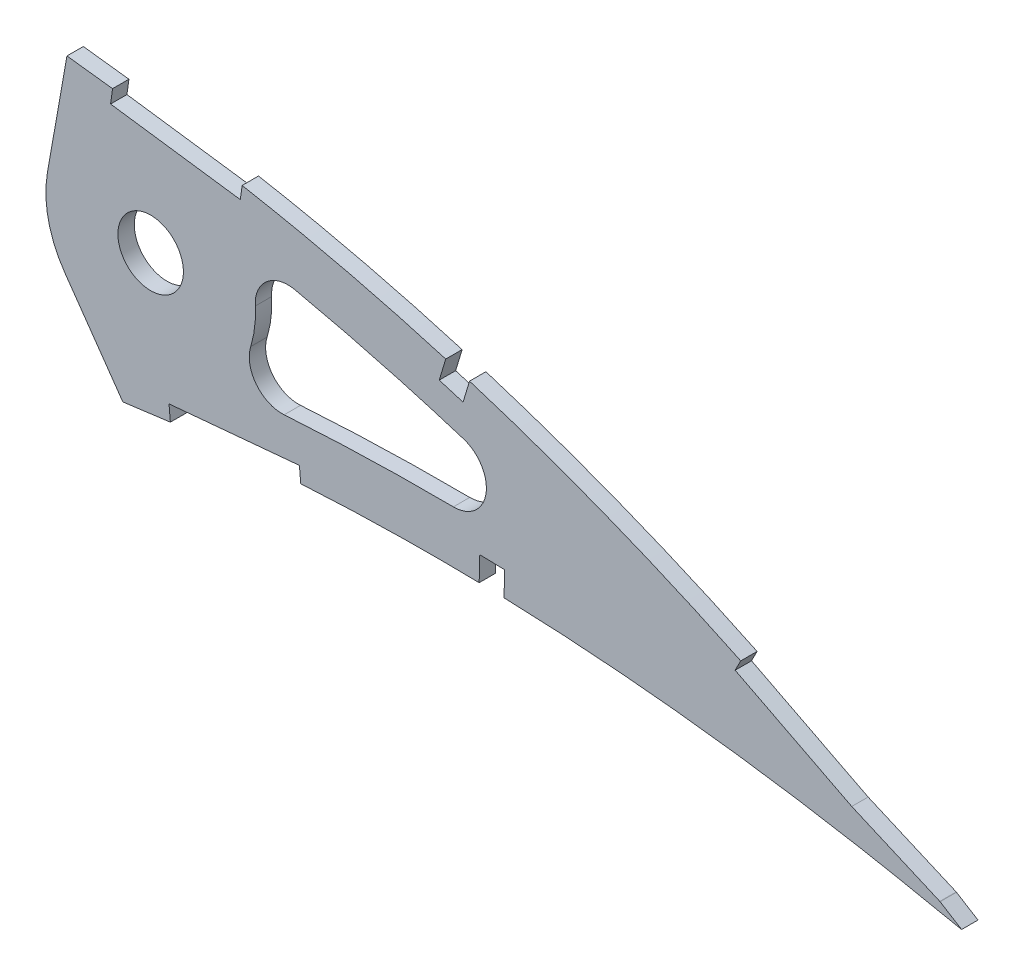
from build123d import *

# Parameters (mm, degrees)
BOSS_EXTRUDE1_DEPTH = 3.175
CUT_EXTRUDE3_DEPTH  = 529.531996169
CUT_EXTRUDE4_DEPTH  = 7.62
FILLET1_R           = 6.35


with BuildPart() as part:
    # Sketch1 → Boss-Extrude1 (new body)
    with BuildSketch(Plane.XY):
        with BuildLine():
            Line((519.580178516, -0.811051185), (524.404942797, -1.768650656))
            Line((524.404942797, -1.768650656), (520.229019484, 0.811051185))
            add(Edge.make_bspline(
                [(520.229019484, 0.811051185), (520.189166605, 0.835670541), (520.029909792, 0.934052399), (519.671075297, 1.154156729), (519.073541109, 1.52075127), (518.237045599, 2.031290225), (517.162238007, 2.684417324), (515.848577801, 3.475559373), (514.296885216, 4.402146321), (512.507535633, 5.459795421), (510.480712337, 6.64355473), (508.21718701, 7.948628257), (505.717156954, 9.367627965), (502.981590452, 10.894755239), (500.011426026, 12.522747531), (496.807225449, 14.244251548), (493.37013628, 16.050511122), (489.701477824, 17.933756977), (485.801919013, 19.88358962), (481.673298347, 21.891894303), (477.316991217, 23.948657398), (472.734484625, 26.042905917), (467.928411224, 28.166102482), (462.900099753, 30.30504754), (457.652415647, 32.45047346), (452.187593096, 34.590170691), (446.508867721, 36.714394111), (440.618430338, 38.809382682), (434.52068427, 40.865980983), (428.218587641, 42.870829), (421.71664718, 44.813038248), (415.018640596, 46.680016502), (408.130151416, 48.4621889), (401.05554842, 50.146576673), (393.800827801, 51.721905645), (386.37175624, 53.178690862), (378.7745642, 54.502388693), (371.03030434, 55.691966852), (363.263579962, 56.681494561), (355.512835044, 57.651994424), (347.773632806, 58.563690257), (339.939841334, 59.436765181), (332.018997168, 60.266303487), (324.018957152, 61.049711288), (315.947820171, 61.783607472), (307.813973652, 62.465839869), (299.625288266, 63.092542591), (291.390398495, 63.662750235), (283.117445562, 64.171449818), (274.815241205, 64.618259557), (266.492213302, 65.000063177), (258.157023363, 65.314229919), (249.818522106, 65.558863312), (241.485365181, 65.731619671), (233.166575282, 65.831412809), (224.870805251, 65.855515939), (216.607073574, 65.803497941), (208.384033719, 65.673572684), (200.210713382, 65.463961556), (192.095777843, 65.174273359), (184.048002143, 64.804633746), (176.076197788, 64.351947189), (168.189012741, 63.819098613), (160.39523005, 63.203849575), (152.703412853, 62.5060365), (145.121622257, 61.728568125), (137.65829938, 60.86932984), (130.321442651, 59.930766435), (123.119077117, 58.914718085), (116.059284027, 57.820631377), (109.149625996, 56.651666482), (102.397560522, 55.409019412), (95.81023125, 54.096333304), (89.394810054, 52.713950514), (83.158087983, 51.266017865), (77.106546628, 49.75505799), (71.246691254, 48.18383703), (65.58446207, 46.556125144), (60.125584795, 44.875615234), (54.876423204, 43.144153764), (49.840944503, 41.368305654), (45.025334256, 39.549331576), (40.433281375, 37.692835265), (36.070167381, 35.80135162), (31.939251719, 33.880646801), (28.045209615, 31.932907511), (24.39081638, 29.963590665), (20.979740738, 27.975715944), (17.815266227, 25.972975661), (14.898722839, 23.96044987), (12.234131686, 21.939401784), (9.822408113, 19.914938493), (7.665078309, 17.890142748), (5.765226023, 15.866409302), (4.122782784, 13.847302025), (2.739901149, 11.834419923), (1.61682102, 9.829667672), (0.75608259, 7.834501578), (0.156832386, 5.85004365), (-0.171193188, 3.879222922), (-0.252840734, 1.920459398), (-0.084154315, 0.639196632), (0, 0)],
                knots=[0, 0, 0, 0, 0.00025409, 0.001015373, 0.002283359, 0.004056577, 0.006330982, 0.009105275, 0.012374489, 0.016134023, 0.02037966, 0.025105976, 0.030306237, 0.035972206, 0.042099522, 0.048678064, 0.055701664, 0.063160184, 0.071045824, 0.079349826, 0.08806291, 0.097175757, 0.106678112, 0.116561573, 0.126814276, 0.1374283, 0.148393618, 0.15969976, 0.171338126, 0.183297699, 0.195569604, 0.208143556, 0.221011593, 0.234161831, 0.24758745, 0.261276822, 0.27522271, 0.289414144, 0.3037712, 0.317689227, 0.331784111, 0.346039677, 0.36044387, 0.374982721, 0.389640455, 0.404403317, 0.419256601, 0.434186749, 0.449177265, 0.464214782, 0.479284009, 0.49436974, 0.509457833, 0.524532346, 0.53957932, 0.554582984, 0.569529546, 0.584403417, 0.599190992, 0.613876838, 0.628447475, 0.642888675, 0.657186054, 0.671325546, 0.685294014, 0.699078147, 0.712665095, 0.726042645, 0.739197713, 0.752117586, 0.764792042, 0.777208152, 0.789355685, 0.80122396, 0.812803686, 0.824082909, 0.835054602, 0.845709571, 0.856037853, 0.866033834, 0.875688843, 0.884997719, 0.893953426, 0.902552897, 0.910789386, 0.918660734, 0.926166253, 0.933302626, 0.94007122, 0.94647478, 0.952517526, 0.958204819, 0.963546652, 0.9685566, 0.973249913, 0.977651041, 0.981787043, 0.985694226, 0.989415109, 0.993001157, 0.996508416, 1, 1, 1, 1], degree=3))
            add(Edge.make_bspline(
                [(0, 0), (0.133592971, -0.630647919), (0.401392883, -1.8948421), (1.12897029, -3.714757932), (2.091156676, -5.464224213), (3.308146123, -7.138593951), (4.771846833, -8.737409521), (6.479026026, -10.262333902), (8.42800953, -11.712547121), (10.616246406, -13.087389262), (13.040557967, -14.388319695), (15.69821927, -15.614529628), (18.58680706, -16.765635887), (21.703174164, -17.840099654), (25.043510698, -18.839557444), (28.604640883, -19.761573512), (32.382515332, -20.607436647), (36.373500457, -21.374987622), (40.573247311, -22.065006311), (44.977392966, -22.677106427), (49.581416855, -23.211670923), (54.380802091, -23.667578066), (59.370801609, -24.045808466), (64.546441805, -24.346612989), (69.902698778, -24.570945614), (75.434441794, -24.717953346), (81.136253147, -24.789928223), (87.002979994, -24.787950681), (93.028883282, -24.711491768), (99.208815464, -24.564775433), (105.536846201, -24.346872236), (112.007262561, -24.060419153), (118.614228145, -23.708298892), (125.351817225, -23.291705179), (132.214100493, -22.812484346), (139.195119589, -22.274479418), (146.288532921, -21.679032497), (153.488154076, -21.029614162), (160.787609185, -20.329475604), (168.180591644, -19.580832593), (175.660575836, -18.787206853), (183.220899465, -17.951170059), (190.855131019, -17.077182461), (198.556296664, -16.166825422), (206.317884213, -15.225296547), (214.132591981, -14.254394805), (221.993885293, -13.257859815), (229.894693671, -12.240383742), (237.827620604, -11.201850487), (245.785993956, -10.149659277), (253.762138918, -9.082943465), (261.749112783, -8.007189221), (269.739522148, -6.925740253), (277.725584215, -5.838929488), (285.70027901, -4.751260828), (293.656208576, -3.665720235), (301.585579958, -2.582406874), (309.481219182, -1.506705212), (317.335175518, -0.438483792), (325.140206955, 0.620091626), (332.888833934, 1.665861231), (340.573746099, 2.697505345), (348.187015915, 3.714371056), (355.720983847, 4.716840325), (363.055280122, 5.674485749), (370.170740115, 6.638302095), (377.091341637, 7.428417974), (383.925772848, 8.102810237), (390.681133097, 8.655718896), (397.349310673, 9.095098533), (403.922665289, 9.424088714), (410.393362863, 9.647282626), (416.753229966, 9.771301523), (422.994322965, 9.799292754), (429.108122993, 9.740182902), (435.086678505, 9.598736647), (440.921645401, 9.381302955), (446.604883368, 9.095217537), (452.128319892, 8.748279397), (457.483662622, 8.34560601), (462.663449177, 7.896598156), (467.65968785, 7.407828642), (472.464706853, 6.884881883), (477.071494939, 6.338715544), (481.472678479, 5.77292572), (485.661637464, 5.196810252), (489.631628754, 4.616207627), (493.376364947, 4.038530197), (496.889962423, 3.469289139), (500.16674573, 2.91603967), (503.201581909, 2.38395084), (505.989204715, 1.878219093), (508.525746868, 1.40522509), (510.806198597, 0.967318665), (512.827510034, 0.571716412), (514.585922757, 0.220164109), (516.078859088, -0.082385429), (517.303711765, -0.334738039), (518.258620558, -0.532751237), (518.941699265, -0.676741413), (519.352209069, -0.762422848), (519.534603778, -0.801329602), (519.580178516, -0.811051185)],
                knots=[0, 0, 0, 0, 0.003638255, 0.007293231, 0.011028136, 0.014901081, 0.018963272, 0.023258475, 0.027820626, 0.032679082, 0.03785316, 0.043361875, 0.049214679, 0.055422346, 0.061988786, 0.068918036, 0.076211157, 0.083868392, 0.091887411, 0.100265912, 0.108999867, 0.118084529, 0.127514843, 0.13728527, 0.147387917, 0.157816481, 0.168563473, 0.179619128, 0.190977373, 0.202626974, 0.214560478, 0.226767249, 0.239236417, 0.251959004, 0.264923894, 0.278119703, 0.291536035, 0.30516028, 0.318980685, 0.332985499, 0.34716279, 0.361498603, 0.375980747, 0.390597192, 0.405332593, 0.420174823, 0.435109533, 0.450124276, 0.465203068, 0.480333154, 0.495500583, 0.510689775, 0.525887334, 0.541078314, 0.556247233, 0.571381784, 0.586466041, 0.601484516, 0.616424329, 0.631269422, 0.646006524, 0.660620684, 0.675098188, 0.689422858, 0.703581825, 0.716907564, 0.730009274, 0.742952128, 0.755725558, 0.768319952, 0.780724337, 0.792926529, 0.804916041, 0.816679084, 0.828203524, 0.8394749, 0.850481359, 0.861207697, 0.871639326, 0.881763414, 0.891563605, 0.901027364, 0.910138977, 0.918883976, 0.927249278, 0.935221104, 0.942784739, 0.949928188, 0.956638464, 0.962904203, 0.968712287, 0.974054485, 0.978918432, 0.983297219, 0.987180246, 0.990560674, 0.993433357, 0.995790625, 0.997629587, 0.998945816, 0.999736592, 1, 1, 1, 1], degree=3))
        make_face()
    extrude(amount=BOSS_EXTRUDE1_DEPTH)

    # Sketch4 → Cut-Extrude3 (cut, through all)
    with BuildSketch(Plane(origin=(0, 0, 0), x_dir=(-1, 0, 0), z_dir=(0, 0, -1))):
        with BuildLine():
            Line((-349.142459993, 48.169188001), (-347.130907312, 36.761105856))
            ThreePointArc((-347.130907312, 36.761105856), (-346.899524588, 35.003579579), (-346.822200854, 33.232574886))
            ThreePointArc((-346.822200854, 33.232574886), (-347.762672414, 27.12223304), (-350.497031314, 21.577501699))
            Line((-350.497031314, 21.577501699), (-355.179611663, 14.890083907))
            add(Edge.make_bspline(
                [(-355.179611663, 14.890083907), (-354.634768183, 14.81838126), (-351.343111064, 14.384733115), (-345.317068282, 13.581422906), (-334.359007699, 12.116770486), (-315.178957353, 9.528809507), (-287.808238346, 5.789020446), (-254.983546479, 1.313075622), (-222.189540662, -3.034811338), (-189.410638648, -7.095853132), (-156.653979445, -10.650756055), (-129.381299848, -12.944898136), (-107.608324737, -14.148463497), (-91.320521139, -14.652053641), (-75.107437099, -14.647466184), (-61.710842675, -14.089664127), (-51.134134813, -13.189629084), (-43.306667964, -12.239557455), (-35.641142462, -10.958898329), (-28.237034853, -9.263609663), (-21.289211903, -7.058302801), (-16.203229259, -4.686643315), (-13.046062847, -2.547825054), (-11.605646483, -1.201001207), (-10.835951724, -0.222672899), (-10.520186588, 0.293626308), (-10.288606614, 0.769486043), (-10.205494123, 0.982386522), (-10.178508929, 1.064293938), (-10.15770337, 1.134911906), (-10.110488282, 1.322521107), (-10.064288932, 1.524878966), (-10.035416174, 1.656454651), (-10.021983668, 1.718504447)],
                knots=[0.309141937, 0.309141937, 0.309141937, 0.309141937, 0.312240805, 0.327852845, 0.343464885, 0.374688966, 0.437137127, 0.499585288, 0.562033448, 0.624481609, 0.68692977, 0.749377931, 0.780602012, 0.811826092, 0.843050173, 0.874274253, 0.889886293, 0.905498334, 0.921110374, 0.936722414, 0.952334454, 0.967946495, 0.975752515, 0.983558535, 0.987461545, 0.991364555, 0.99331606, 0.995267565, 0.996243318, 0.99721907, 0.998194823, 0.998682699, 0.999170575, 0.999170575, 0.999170575, 0.999170575], degree=3))
            add(Edge.make_bspline(
                [(-10.021983668, 1.718504447), (-10.013687856, 1.783768627), (-9.996445529, 1.922731887), (-9.972174442, 2.13380764), (-9.954758577, 2.326720127), (-9.95209276, 2.384964033), (-9.950305509, 2.48525297), (-9.961308657, 2.734439136), (-10.012167255, 3.144193433), (-10.083924075, 3.510172621), (-10.222387191, 4.033107903), (-10.617125097, 5.11754818), (-11.618419928, 6.925188316), (-14.102556964, 10.090723207), (-18.425636817, 14.053423759), (-24.652613537, 18.402785053), (-31.49228206, 22.339174543), (-38.727193503, 25.901322004), (-46.234469632, 29.135461005), (-56.507441507, 33.059973808), (-69.720706242, 37.323053539), (-85.944850414, 41.597783381), (-102.419374763, 45.156825801), (-124.627374805, 49.072607453), (-152.703767215, 52.587446016), (-186.671940606, 55.005427433), (-220.783980102, 55.888644379), (-254.954152119, 55.438562708), (-289.123377617, 53.797708511), (-317.566439881, 51.530591277), (-337.432329226, 49.501787715), (-346.070123739, 48.528859346), (-349.021979224, 48.183312846), (-349.142459993, 48.169188001)],
                knots=[0.000796283, 0.000796283, 0.000796283, 0.000796283, 0.001284176, 0.001772068, 0.002747853, 0.003723638, 0.004699423, 0.006650992, 0.008602562, 0.010554132, 0.012505702, 0.016408841, 0.02421512, 0.032021399, 0.047633957, 0.063246516, 0.078859074, 0.094471632, 0.11008419, 0.125696748, 0.156921864, 0.18814698, 0.219372096, 0.250597212, 0.313047445, 0.375497677, 0.437947909, 0.500398142, 0.562848374, 0.625298606, 0.656523722, 0.67213628, 0.672800692, 0.672800692, 0.672800692, 0.672800692], degree=3))
        make_face()
        with BuildLine():
            ThreePointArc((-360.792200854, 33.232574886), (-367.142200854, 39.582574886), (-373.492200854, 33.232574886))
            ThreePointArc((-373.492200854, 33.232574886), (-367.142200854, 26.882574886), (-360.792200854, 33.232574886))
        make_face()
        with BuildLine():
            Line((-350.909730833, 58.191878985), (-349.142459993, 48.169188001))
            add(Edge.make_bspline(
                [(-10.021983668, 1.718504447), (-10.013687856, 1.783768627), (-9.996445529, 1.922731887), (-9.972174442, 2.13380764), (-9.954758577, 2.326720127), (-9.95209276, 2.384964033), (-9.950305509, 2.48525297), (-9.961308657, 2.734439136), (-10.012167255, 3.144193433), (-10.083924075, 3.510172621), (-10.222387191, 4.033107903), (-10.617125097, 5.11754818), (-11.618419928, 6.925188316), (-14.102556964, 10.090723207), (-18.425636817, 14.053423759), (-24.652613537, 18.402785053), (-31.49228206, 22.339174543), (-38.727193503, 25.901322004), (-46.234469632, 29.135461005), (-56.507441507, 33.059973808), (-69.720706242, 37.323053539), (-85.944850414, 41.597783381), (-102.419374763, 45.156825801), (-124.627374805, 49.072607453), (-152.703767215, 52.587446016), (-186.671940606, 55.005427433), (-220.783980102, 55.888644379), (-254.954152119, 55.438562708), (-289.123377617, 53.797708511), (-317.566439881, 51.530591277), (-337.432329226, 49.501787715), (-346.070123739, 48.528859346), (-349.021979224, 48.183312846), (-349.142459993, 48.169188001)],
                knots=[0.000796283, 0.000796283, 0.000796283, 0.000796283, 0.001284176, 0.001772068, 0.002747853, 0.003723638, 0.004699423, 0.006650992, 0.008602562, 0.010554132, 0.012505702, 0.016408841, 0.02421512, 0.032021399, 0.047633957, 0.063246516, 0.078859074, 0.094471632, 0.11008419, 0.125696748, 0.156921864, 0.18814698, 0.219372096, 0.250597212, 0.313047445, 0.375497677, 0.437947909, 0.500398142, 0.562848374, 0.625298606, 0.656523722, 0.67213628, 0.672800692, 0.672800692, 0.672800692, 0.672800692], degree=3))
            add(Edge.make_bspline(
                [(-355.179611663, 14.890083907), (-354.634768183, 14.81838126), (-351.343111064, 14.384733115), (-345.317068282, 13.581422906), (-334.359007699, 12.116770486), (-315.178957353, 9.528809507), (-287.808238346, 5.789020446), (-254.983546479, 1.313075622), (-222.189540662, -3.034811338), (-189.410638648, -7.095853132), (-156.653979445, -10.650756055), (-129.381299848, -12.944898136), (-107.608324737, -14.148463497), (-91.320521139, -14.652053641), (-75.107437099, -14.647466184), (-61.710842675, -14.089664127), (-51.134134813, -13.189629084), (-43.306667964, -12.239557455), (-35.641142462, -10.958898329), (-28.237034853, -9.263609663), (-21.289211903, -7.058302801), (-16.203229259, -4.686643315), (-13.046062847, -2.547825054), (-11.605646483, -1.201001207), (-10.835951724, -0.222672899), (-10.520186588, 0.293626308), (-10.288606614, 0.769486043), (-10.205494123, 0.982386522), (-10.178508929, 1.064293938), (-10.15770337, 1.134911906), (-10.110488282, 1.322521107), (-10.064288932, 1.524878966), (-10.035416174, 1.656454651), (-10.021983668, 1.718504447)],
                knots=[0.309141937, 0.309141937, 0.309141937, 0.309141937, 0.312240805, 0.327852845, 0.343464885, 0.374688966, 0.437137127, 0.499585288, 0.562033448, 0.624481609, 0.68692977, 0.749377931, 0.780602012, 0.811826092, 0.843050173, 0.874274253, 0.889886293, 0.905498334, 0.921110374, 0.936722414, 0.952334454, 0.967946495, 0.975752515, 0.983558535, 0.987461545, 0.991364555, 0.99331606, 0.995267565, 0.996243318, 0.99721907, 0.998194823, 0.998682699, 0.999170575, 0.999170575, 0.999170575, 0.999170575], degree=3))
            Line((-355.179611663, 14.890083907), (-361.749554482, 5.507233166))
            add(Edge.make_bspline(
                [(-361.749554482, 5.507233166), (-359.750002253, 5.242796176), (-355.23730571, 4.652482144), (-348.187015915, 3.714371056), (-340.573746099, 2.697505345), (-332.888833934, 1.665861231), (-325.140206955, 0.620091626), (-317.335175518, -0.438483792), (-309.481219182, -1.506705212), (-301.585579958, -2.582406874), (-293.656208576, -3.665720235), (-285.70027901, -4.751260828), (-277.725584215, -5.838929488), (-269.739522148, -6.925740253), (-261.749112783, -8.007189221), (-253.762138918, -9.082943465), (-245.785993956, -10.149659277), (-237.827620604, -11.201850487), (-229.894693671, -12.240383742), (-221.993885293, -13.257859815), (-214.132591981, -14.254394805), (-206.317884213, -15.225296547), (-198.556296664, -16.166825422), (-190.855131019, -17.077182461), (-183.220899465, -17.951170059), (-175.660575836, -18.787206853), (-168.180591644, -19.580832593), (-160.787609185, -20.329475604), (-153.488154076, -21.029614162), (-146.288532921, -21.679032497), (-139.195119589, -22.274479418), (-132.214100493, -22.812484346), (-125.351817225, -23.291705179), (-118.614228145, -23.708298892), (-112.007262561, -24.060419153), (-105.536846201, -24.346872236), (-99.208815464, -24.564775433), (-93.028883282, -24.711491768), (-87.002979994, -24.787950681), (-81.136253147, -24.789928223), (-75.434441794, -24.717953346), (-69.902698778, -24.570945614), (-64.546441805, -24.346612989), (-59.370801609, -24.045808466), (-54.380802091, -23.667578066), (-49.581416855, -23.211670923), (-44.977392966, -22.677106427), (-40.573247311, -22.065006311), (-36.373500457, -21.374987622), (-32.382515332, -20.607436647), (-28.604640883, -19.761573512), (-25.043510698, -18.839557444), (-21.703174164, -17.840099654), (-18.58680706, -16.765635887), (-15.69821927, -15.614529628), (-13.040557967, -14.388319695), (-10.616246406, -13.087389262), (-8.42800953, -11.712547121), (-6.479026026, -10.262333902), (-4.771846833, -8.737409521), (-3.308146123, -7.138593951), (-2.091156676, -5.464224213), (-1.12897029, -3.714757932), (-0.401392883, -1.8948421), (-0.133592971, -0.630647919), (0, 0)],
                knots=[0.299176266, 0.299176266, 0.299176266, 0.299176266, 0.310577142, 0.324901812, 0.339379316, 0.353993476, 0.368730578, 0.383575671, 0.398515484, 0.413533959, 0.428618216, 0.443752767, 0.458921686, 0.474112666, 0.489310225, 0.504499417, 0.519666846, 0.534796932, 0.549875724, 0.564890467, 0.579825177, 0.594667407, 0.609402808, 0.624019253, 0.638501397, 0.65283721, 0.667014501, 0.681019315, 0.69483972, 0.708463965, 0.721880297, 0.735076106, 0.748040996, 0.760763583, 0.773232751, 0.785439522, 0.797373026, 0.809022627, 0.820380872, 0.831436527, 0.842183519, 0.852612083, 0.86271473, 0.872485157, 0.881915471, 0.891000133, 0.899734088, 0.908112589, 0.916131608, 0.923788843, 0.931081964, 0.938011214, 0.944577654, 0.950785321, 0.956638125, 0.96214684, 0.967320918, 0.972179374, 0.976741525, 0.981036728, 0.985098919, 0.988971864, 0.992706769, 0.996361745, 1, 1, 1, 1], degree=3))
            add(Edge.make_bspline(
                [(0, 0), (0.084154315, 0.639196632), (0.252840734, 1.920459398), (0.171193188, 3.879222922), (-0.156832386, 5.85004365), (-0.75608259, 7.834501578), (-1.61682102, 9.829667672), (-2.739901149, 11.834419923), (-4.122782784, 13.847302025), (-5.765226023, 15.866409302), (-7.665078309, 17.890142748), (-9.822408113, 19.914938493), (-12.234131686, 21.939401784), (-14.898722839, 23.96044987), (-17.815266227, 25.972975661), (-20.979740738, 27.975715944), (-24.39081638, 29.963590665), (-28.045209615, 31.932907511), (-31.939251719, 33.880646801), (-36.070167381, 35.80135162), (-40.433281375, 37.692835265), (-45.025334256, 39.549331576), (-49.840944503, 41.368305654), (-54.876423204, 43.144153764), (-60.125584795, 44.875615234), (-65.58446207, 46.556125144), (-71.246691254, 48.18383703), (-77.106546628, 49.75505799), (-83.158087983, 51.266017865), (-89.394810054, 52.713950514), (-95.81023125, 54.096333304), (-102.397560522, 55.409019412), (-109.149625996, 56.651666482), (-116.059284027, 57.820631377), (-123.119077117, 58.914718085), (-130.321442651, 59.930766435), (-137.65829938, 60.86932984), (-145.121622257, 61.728568125), (-152.703412853, 62.5060365), (-160.39523005, 63.203849575), (-168.189012741, 63.819098613), (-176.076197788, 64.351947189), (-184.048002143, 64.804633746), (-192.095777843, 65.174273359), (-200.210713382, 65.463961556), (-208.384033719, 65.673572684), (-216.607073574, 65.803497941), (-224.870805251, 65.855515939), (-233.166575282, 65.831412809), (-241.485365181, 65.731619671), (-249.818522106, 65.558863312), (-258.157023363, 65.314229919), (-266.492213302, 65.000063177), (-274.815241205, 64.618259557), (-283.117445562, 64.171449818), (-291.390398495, 63.662750235), (-299.625288266, 63.092542591), (-307.813973652, 62.465839869), (-315.947820171, 61.783607472), (-324.018957152, 61.049711288), (-332.018997168, 60.266303487), (-339.939841334, 59.436765181), (-346.227461312, 58.736010846), (-349.87402552, 58.313335631), (-350.909730833, 58.191878985)],
                knots=[0, 0, 0, 0, 0.003491584, 0.006998843, 0.010584891, 0.014305774, 0.018212957, 0.022348959, 0.026750087, 0.0314434, 0.036453348, 0.041795181, 0.047482474, 0.05352522, 0.05992878, 0.066697374, 0.073833747, 0.081339266, 0.089210614, 0.097447103, 0.106046574, 0.115002281, 0.124311157, 0.133966166, 0.143962147, 0.154290429, 0.164945398, 0.175917091, 0.187196314, 0.19877604, 0.210644315, 0.222791848, 0.235207958, 0.247882414, 0.260802287, 0.273957355, 0.287334905, 0.300921853, 0.314705986, 0.328674454, 0.342813946, 0.357111325, 0.371552525, 0.386123162, 0.400809008, 0.415596583, 0.430470454, 0.445417016, 0.46042068, 0.475467654, 0.490542167, 0.50563026, 0.520715991, 0.535785218, 0.550822735, 0.565813251, 0.580743399, 0.595596683, 0.610359545, 0.625017279, 0.63955613, 0.653960323, 0.668215889, 0.673872202, 0.673872202, 0.673872202, 0.673872202], degree=3))
        make_face()
        with BuildLine():
            ThreePointArc((-387.462200854, 33.232574886), (-386.814379612, 38.322543737), (-384.912222221, 43.087966334))
            add(Edge.make_bspline(
                [(-384.912222221, 43.087966334), (-386.818824475, 42.732614345), (-394.210424123, 41.294453801), (-407.028210468, 38.374212868), (-428.620355258, 32.39115288), (-448.413992243, 25.407269546), (-462.57734912, 19.420041956), (-466.382547126, 17.738579891)],
                knots=[0.739380826, 0.739380826, 0.739380826, 0.739380826, 0.750199071, 0.781424187, 0.812649303, 0.875099535, 0.898258577, 0.898258577, 0.898258577, 0.898258577], degree=3))
            add(Edge.make_bspline(
                [(-466.382547126, 17.738579891), (-462.513007229, 18.118917697), (-447.384629134, 19.418402411), (-426.536653446, 20.177211731), (-403.909109388, 19.686350489), (-390.476664545, 18.867911853), (-382.696670013, 18.178863487), (-380.561422835, 17.973909105)],
                knots=[0.103390506, 0.103390506, 0.103390506, 0.103390506, 0.124896322, 0.187344483, 0.218568563, 0.249792644, 0.26163416, 0.26163416, 0.26163416, 0.26163416], degree=3))
            ThreePointArc((-380.561422835, 17.973909105), (-385.656803073, 24.859289708), (-387.462200854, 33.232574886))
        make_face()
    extrude(amount=-CUT_EXTRUDE3_DEPTH, mode=Mode.SUBTRACT)

    # Sketch5 → Cut-Extrude4 (cut)
    with BuildSketch(Plane.XY.offset(3.175)):
        Polygon((384.961328648, 54.016498288), (359.803806164, 57.490736253), (359.369526419, 54.346045943), (384.527048903, 50.871807978), align=None)
        Polygon((395.984366342, 11.965923207), (370.698815929, 9.653682873), (370.98784597, 6.492989071), (396.273396384, 8.805229405), align=None)
        Polygon((429.117858019, 43.070336902), (424.499319283, 44.464099147), (423.105557039, 39.845560411), (427.724095775, 38.451798166), align=None)
        Polygon((435.786991484, 14.341315593), (430.963938334, 14.459159398), (430.846094529, 9.636106247), (435.66914768, 9.518262443), align=None)
        Polygon((504.452510222, 11.115204058), (481.935027394, 22.642294806), (480.48827192, 19.816144458), (503.097474702, 8.242100672), (526.404447181, -1.854547191), (527.666528163, 1.058824369), align=None)
    extrude(amount=-CUT_EXTRUDE4_DEPTH, mode=Mode.SUBTRACT)

    # Fillet1
    fillet1_edges = [part.edges().sort_by_distance(p)[0] for p in [
        (466.382547126, 17.738579891, 1.5875),
        (380.561422835, 17.973909105, 1.5875),
        (384.912222221, 43.087966334, 1.5875),
    ]]
    fillet(fillet1_edges, radius=FILLET1_R)


solid = part.part
